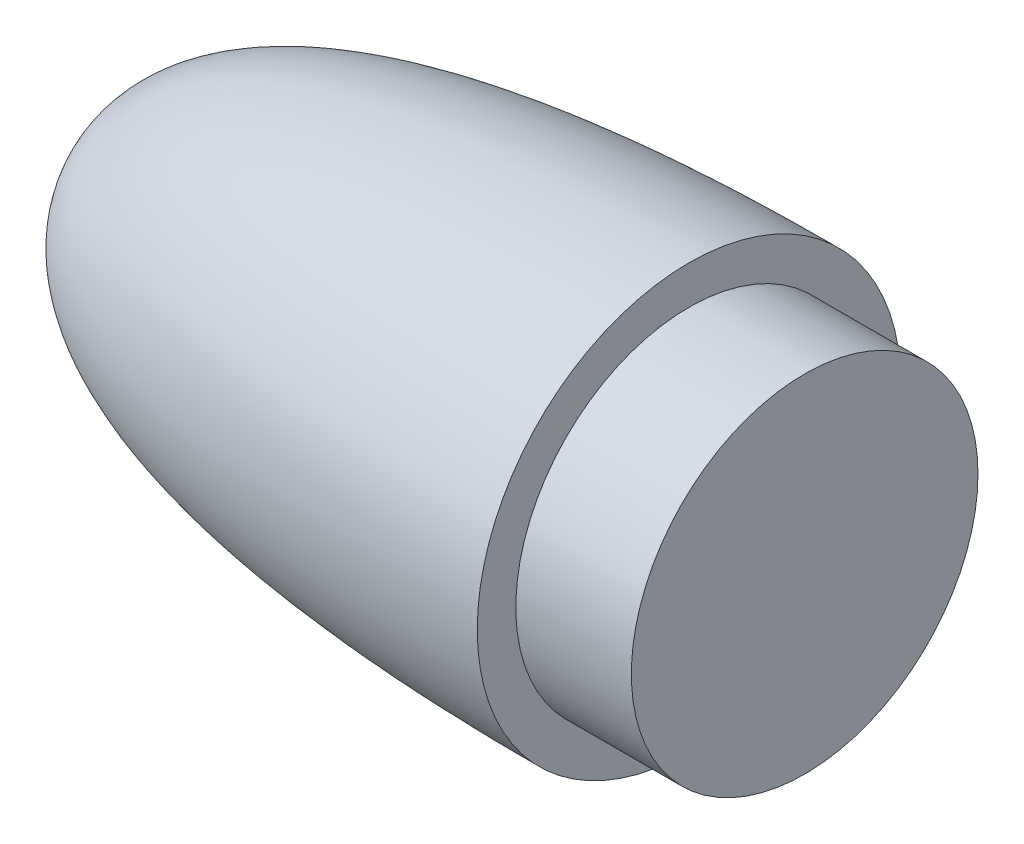
from build123d import *

# Parameters (mm, degrees)
SKETCH1_W = 15
SKETCH1_H = 22.5


with BuildPart() as part:
    # Sketch1 → Revolve2 (revolve)
    with BuildSketch(Plane(origin=(0, 0, 0), x_dir=(1, 0, 0), z_dir=(0, 1, 0))):
        with BuildLine():
            Line((-91.2, 22.5), (-15, 22.5))
            Line((-15, 22.5), (-15, 45))
            Line((-15, 45), (-15, 50))
            add(Edge.make_bspline(
                [(-15, 50), (-91.2, 50), (-91.2, 22.5)],
                knots=[0, 0, 0, 1, 1, 1], degree=2))
        make_face()
        with Locations((-7.5, 33.75)):
            Rectangle(SKETCH1_W, SKETCH1_H)
    revolve(axis=Axis((-15, 0, -22.5), (-1, 0, 0)))


solid = part.part
